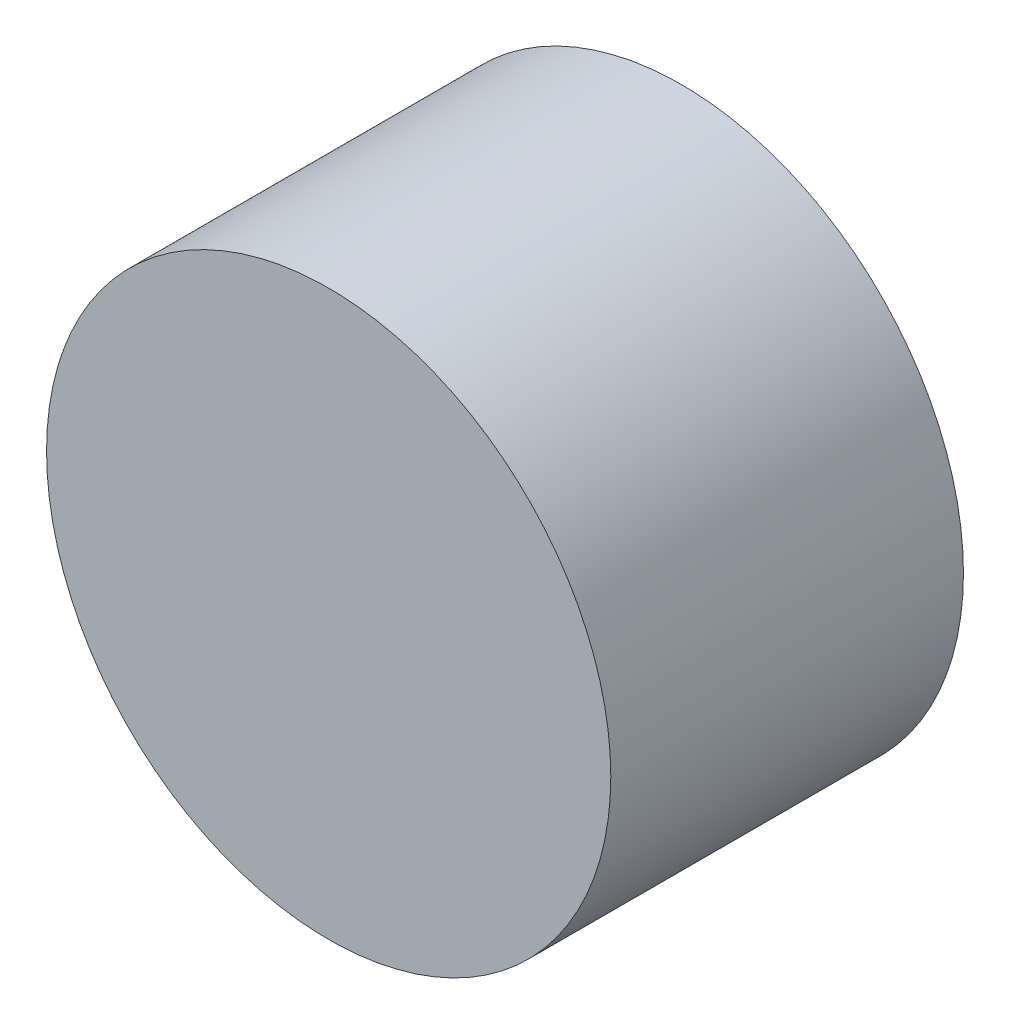
from build123d import *

# Parameters (mm, degrees)
SKETCH_1_R          = 6.5
EXTRUDE_1_DEPTH     = 4
SKETCH_2_OUTSIDE_W  = 18.762
SKETCH_2_OUTSIDE_H  = 18.762
SKETCH_2_OUTSIDE_R  = 3.2
CUT_EXTRUDE_1_DEPTH = 4


with BuildPart() as part:
    # 草图1 → 凸台-拉伸1 (new body)
    with BuildSketch(Plane.XY):
        Circle(SKETCH_1_R)
    extrude(amount=EXTRUDE_1_DEPTH)

    # 草图2 outside → 切除-拉伸1 (cut)
    with BuildSketch(Plane(origin=(0, 0, 0), x_dir=(-1, 0, 0), z_dir=(0, 0, -1))):
        Rectangle(SKETCH_2_OUTSIDE_W, SKETCH_2_OUTSIDE_H)
        Circle(SKETCH_2_OUTSIDE_R, mode=Mode.SUBTRACT)
    extrude(amount=-CUT_EXTRUDE_1_DEPTH, mode=Mode.SUBTRACT)


solid = part.part
